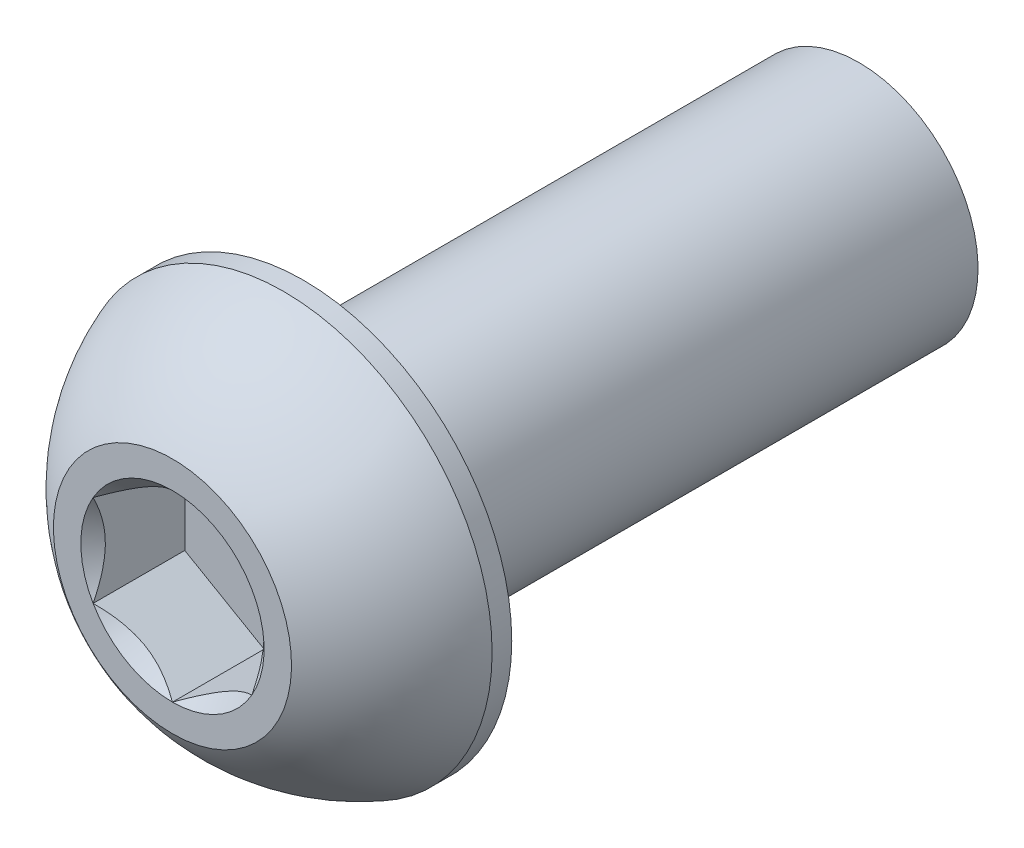
from build123d import *

# Parameters (mm, degrees)
SKETCH1_W              = 14
SKETCH1_H              = 3
CUT_EXTRUDE2_DEPTH     = 2.31
SPLIT1_SURFACE_1_BACK  = 23.799
SPLIT1_SURFACE_1_DEPTH = 47.598
SPLIT1_SURFACE_2_BACK  = 23.799
SPLIT1_SURFACE_2_DEPTH = 47.598


with BuildPart() as part:
    # Sketch1 → Revolve1 (revolve)
    with BuildSketch(Plane(origin=(0, 0, 0), x_dir=(0, 0, -1), z_dir=(1, 0, 0))):
        with Locations((10.3, 1.5)):
            Rectangle(SKETCH1_W, SKETCH1_H)
    revolve(axis=Axis((0, 0, -17.3), (0, 0, 1)))

    # Sketch7 → Revolve2 (revolve)
    with BuildSketch(Plane(origin=(0, 0, 0), x_dir=(0, 0, -1), z_dir=(1, 0, 0))):
        with BuildLine():
            Line((2.805, 5.25), (3.3, 5.25))
            Line((3.3, 5.25), (3.3, 0))
            Line((3.3, 0), (0, 0))
            Line((0, 0), (0, 3))
            ThreePointArc((0, 3), (1.216479019, 4.356906156), (2.805, 5.25))
        make_face()
    revolve(axis=Axis((0, 0, 0), (0, 0, -1)))

    # Sketch5 → Cut-Extrude2 (cut)
    with BuildSketch(Plane.XY):
        Polygon((2, -1.154700538), (2, 1.154700538), (0, 2.309401077), (-2, 1.154700538), (-2, -1.154700538), (0, -2.309401077), align=None)
    extrude(amount=-CUT_EXTRUDE2_DEPTH, mode=Mode.SUBTRACT)

    # Cut-Extrude3 cone 1 section (through the dimple's axis) → Cut-Extrude3 (revolve, cut)
    with BuildSketch(Plane(origin=(0, 0, 0), x_dir=(0, -1, 0), z_dir=(1, 0, 0))):
        Polygon((0, 0), (2.309401077, 0), (0, 2.309401077), align=None)
    revolve(axis=Axis((0, 0, 0), (0, 0, -1)), mode=Mode.SUBTRACT)


with BuildPart() as body_2:
    # Split1: the piece behind the surface
    add(part.part)
    # Split1 surface: a surface, the sketch's curves swept straight by 47.598 mm
    with BuildLine(Plane(origin=(0, 0, 0), x_dir=(0, 0, -1), z_dir=(1, 0, 0)).offset(-SPLIT1_SURFACE_1_BACK), mode=Mode.PRIVATE) as split1_surface_1_path:
        Line((3.3, -5.25), (3.3, 5.25))
    split1_surface_1 = Shell.extrude(split1_surface_1_path.wire(), (1 * SPLIT1_SURFACE_1_DEPTH, 0 * SPLIT1_SURFACE_1_DEPTH, 0 * SPLIT1_SURFACE_1_DEPTH))
    split(bisect_by=split1_surface_1, keep=Keep.BOTTOM)


with BuildPart() as part_1:
    add(part.part)

    # Split1: split by a surface, the side it looks to stays
    # Split1 surface: a surface, the sketch's curves swept straight by 47.598 mm
    with BuildLine(Plane(origin=(0, 0, 0), x_dir=(0, 0, -1), z_dir=(1, 0, 0)).offset(-SPLIT1_SURFACE_2_BACK), mode=Mode.PRIVATE) as split1_surface_2_path:
        Line((3.3, -5.25), (3.3, 5.25))
    split1_surface_2 = Shell.extrude(split1_surface_2_path.wire(), (1 * SPLIT1_SURFACE_2_DEPTH, 0 * SPLIT1_SURFACE_2_DEPTH, 0 * SPLIT1_SURFACE_2_DEPTH))
    split(bisect_by=split1_surface_2, keep=Keep.TOP)


solid = Compound([body_2.part, part_1.part])
